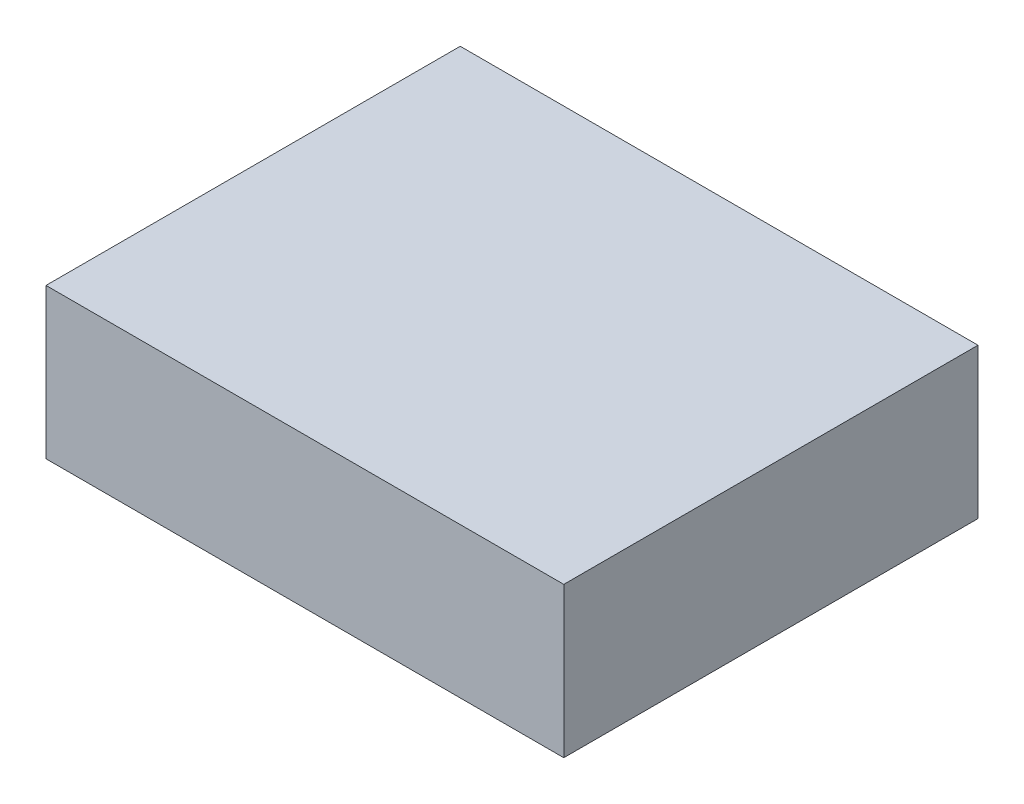
from build123d import *

# Parameters (mm, degrees)
SKETCH1_W           = 100
SKETCH1_H           = 80
BOSS_EXTRUDE1_DEPTH = 29


with BuildPart() as part:
    # Sketch1 → Boss-Extrude1 (new body)
    with BuildSketch(Plane(origin=(0, 0, 0), x_dir=(1, 0, 0), z_dir=(0, 1, 0))):
        Rectangle(SKETCH1_W, SKETCH1_H)
    extrude(amount=BOSS_EXTRUDE1_DEPTH)


solid = part.part
